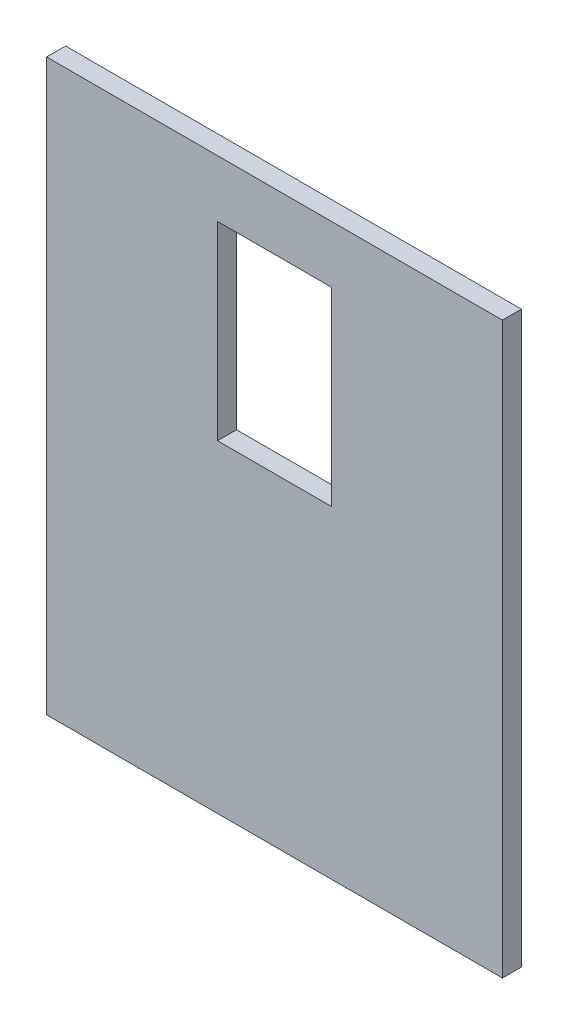
from build123d import *

# Parameters (mm, degrees)
SKETCH1_W           = 120
SKETCH1_H           = 150
SKETCH1_W_2         = 30
SKETCH1_H_2         = 50
BOSS_EXTRUDE1_DEPTH = 5


with BuildPart() as part:
    # Sketch1 → Boss-Extrude1 (new body)
    with BuildSketch(Plane.XY):
        Rectangle(SKETCH1_W, SKETCH1_H)
        with Locations((0, 35)):
            Rectangle(SKETCH1_W_2, SKETCH1_H_2, mode=Mode.SUBTRACT)
    extrude(amount=-BOSS_EXTRUDE1_DEPTH)


solid = part.part
